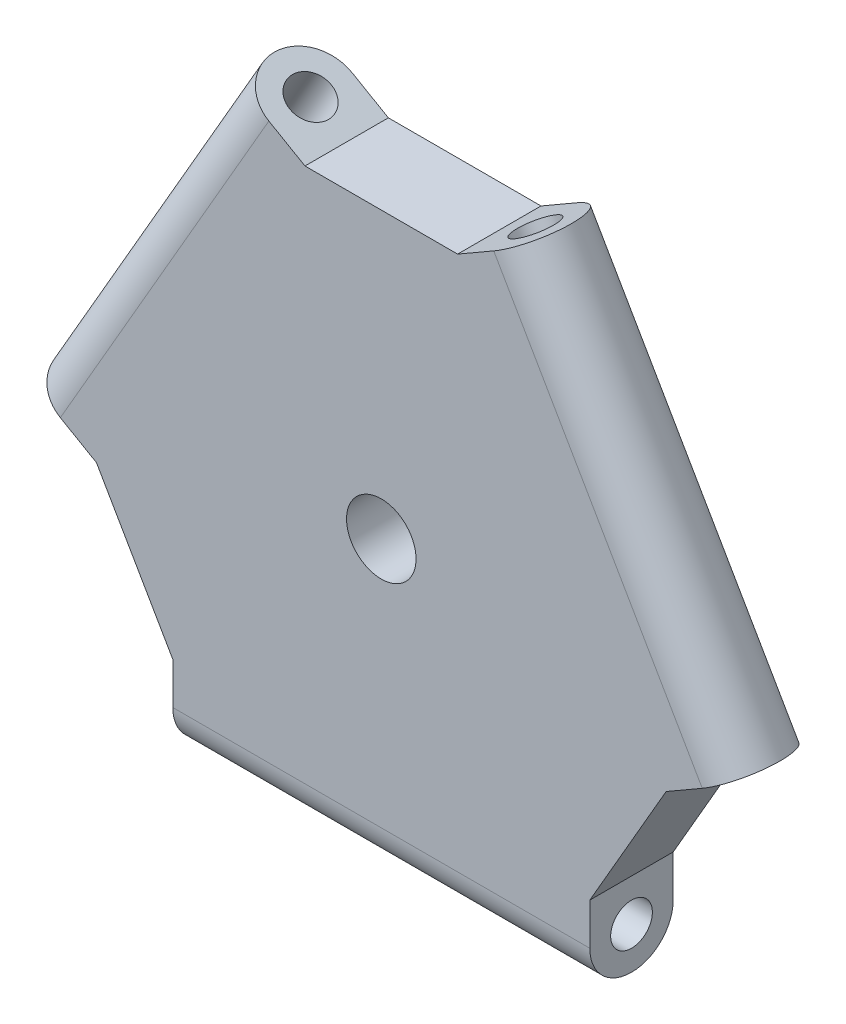
from build123d import *

# Parameters (mm, degrees)
EXTRUDE_1_DEPTH          = 12
SKETCH_2_R               = 6
EXTRUDE_2_DEPTH          = 30
SKETCH_3_R               = 3
CUT_EXTRUDE_1_DEPTH      = 103.282410285
SKETCH_5_R               = 5
CUT_EXTRUDE_2_DEPTH      = 81.274528962
CUT_EXTRUDE_3_DEPTH      = 81.274528962
PATTERN_CIRCULAR_2_COUNT = 3
SKETCH_7_R               = 3
CUT_EXTRUDE_4_DEPTH      = 100.361803703
SKETCH_8_R               = 3
CUT_EXTRUDE_5_DEPTH      = 96.764127078


with BuildPart() as part:
    # 草图1 → 凸台-拉伸1 (new body)
    with BuildSketch(Plane.XY):
        Polygon((0, 60), (-51.961524227, -30), (51.961524227, -30), align=None)
    extrude(amount=EXTRUDE_1_DEPTH)

    # 草图2 → 凸台-拉伸2 (add, symmetric)
    with BuildSketch(Plane(origin=(0, 0, 0), x_dir=(0, 0, -1), z_dir=(1, 0, 0))):
        with Locations((-6, -36)):
            Circle(SKETCH_2_R)
        with BuildLine():
            ThreePointArc((-6, -30), (-1.757359313, -31.757359313), (0, -36))
            Line((0, -36), (0, -30))
            Line((0, -30), (-6, -30))
        make_face()
        with BuildLine():
            Line((-12, -30), (-12, -36))
            ThreePointArc((-12, -36), (-10.242640687, -31.757359313), (-6, -30))
            Line((-6, -30), (-12, -30))
        make_face()
    extrude_2 = extrude(amount=EXTRUDE_2_DEPTH, both=True)

    # 草图3 → 切除-拉伸1 (cut, through all)
    with BuildSketch(Plane(origin=(30, 0, 0), x_dir=(0, 0, -1), z_dir=(1, 0, 0))):
        with Locations((-6, -36)):
            Circle(SKETCH_3_R)
    extrude(amount=-CUT_EXTRUDE_1_DEPTH, mode=Mode.SUBTRACT)

    # 草图5 → 切除-拉伸2 (cut, through all)
    with BuildSketch(Plane(origin=(0, 0, 0), x_dir=(-1, 0, 0), z_dir=(0, 0, -1))):
        Circle(SKETCH_5_R)
    extrude(amount=-CUT_EXTRUDE_2_DEPTH, mode=Mode.SUBTRACT)

    # 草图6 → 切除-拉伸3 (cut, through all)
    with BuildSketch(Plane(origin=(0, 0, 0), x_dir=(-1, 0, 0), z_dir=(0, 0, -1))):
        Polygon((-30, -30), (-51.961524227, -30), (-40.980762114, -10.980762114), align=None)
        Polygon((10.980762114, 40.980762114), (-10.980762114, 40.980762114), (0, 60), align=None)
        Polygon((30, -30), (40.980762114, -10.980762114), (51.961524227, -30), align=None)
    extrude(amount=-CUT_EXTRUDE_3_DEPTH, mode=Mode.SUBTRACT)

    # 阵列(圆周)2: 凸台-拉伸2 ×3 about axis
    pattern_circular_2_axis = Axis((0, 0, 0), (0, 0, 1))
    for i in range(1, PATTERN_CIRCULAR_2_COUNT):
        add(extrude_2.rotate(pattern_circular_2_axis, i * 360 / PATTERN_CIRCULAR_2_COUNT))

    # 草图7 → 切除-拉伸4 (cut, through all)
    with BuildSketch(Plane(origin=(15, -25.980762114, 0), x_dir=(0.8660254037844434, 0.49999999999999195, 0), z_dir=(0.49999999999999195, -0.8660254037844434, 0))):
        with Locations((36, 6)):
            Circle(SKETCH_7_R)
    extrude(amount=-CUT_EXTRUDE_4_DEPTH, mode=Mode.SUBTRACT)

    # 草图8 → 切除-拉伸5 (cut, through all)
    with BuildSketch(Plane(origin=(15, 25.980762114, 0), x_dir=(0.8660254037844363, -0.5000000000000043, 0), z_dir=(0.5000000000000042, 0.8660254037844362, 0))):
        with Locations(Location((-36, -6, 0), (0, 0, 180))):
            Circle(SKETCH_8_R)
    extrude(amount=-CUT_EXTRUDE_5_DEPTH, mode=Mode.SUBTRACT)


solid = part.part
